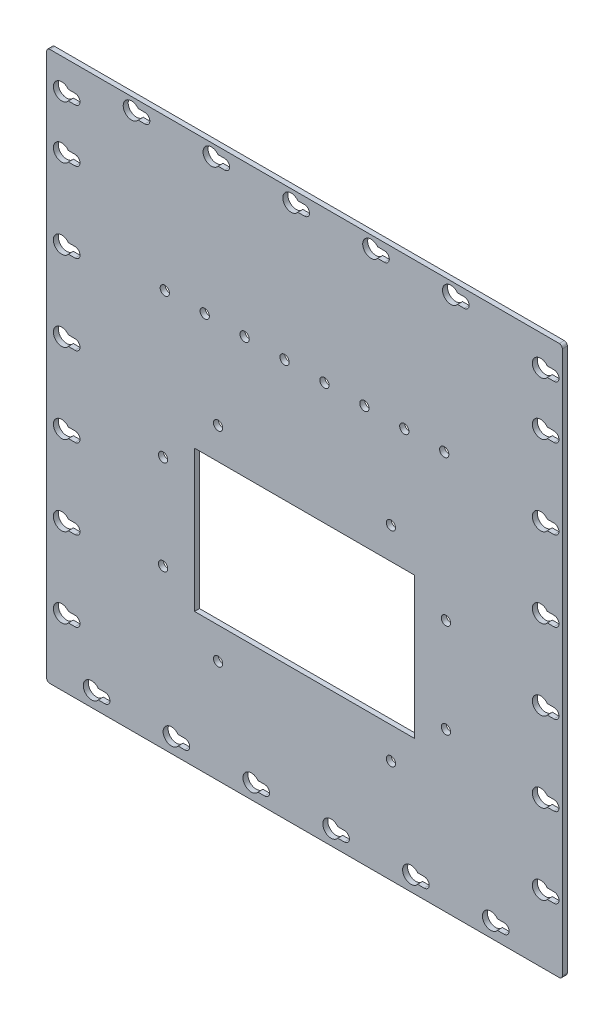
from build123d import *

# Parameters (mm, degrees)
SKETCH1_W                = 164.1
SKETCH1_H                = 174.745
BOSS_EXTRUDE1_DEPTH      = 1.5875
FILLET1_R                = 1
SKETCH2_R                = 1.4732
CUT_EXTRUDE1_DEPTH       = 10
HEAT_STRAP_CONNECTIONS_R = 1.4732
CUT_EXTRUDE2_DEPTH       = 241.065605994


with BuildPart() as part:
    # Sketch1 → Boss-Extrude1 (new body)
    with BuildSketch(Plane.XY):
        with Locations((82.55, -87.3725)):
            Rectangle(SKETCH1_W, SKETCH1_H)
        with BuildLine():
            Line((82.55, -5.4375), (80.434372699, -5.4375))
            ThreePointArc((80.434372699, -5.4375), (75.6625, -3.85), (80.434372699, -2.2625))
            Line((80.434372699, -2.2625), (82.55, -2.2625))
            ThreePointArc((82.55, -2.2625), (84.1375, -3.85), (82.55, -5.4375))
        make_face(mode=Mode.SUBTRACT)
        with BuildLine():
            Line((16.934372699, -168.395), (19.05, -168.395))
            ThreePointArc((19.05, -168.395), (20.6375, -169.9825), (19.05, -171.57))
            Line((19.05, -171.57), (16.934372699, -171.57))
            ThreePointArc((16.934372699, -171.57), (12.1625, -169.9825), (16.934372699, -168.395))
        make_face(mode=Mode.SUBTRACT)
        with BuildLine():
            Line((7.409372699, -151.9325), (9.525, -151.9325))
            ThreePointArc((9.525, -151.9325), (11.1125, -153.52), (9.525, -155.1075))
            Line((9.525, -155.1075), (7.409372699, -155.1075))
            ThreePointArc((7.409372699, -155.1075), (2.6375, -153.52), (7.409372699, -151.9325))
        make_face(mode=Mode.SUBTRACT)
        with BuildLine():
            Line((42.334372699, -168.395), (44.45, -168.395))
            ThreePointArc((44.45, -168.395), (46.0375, -169.9825), (44.45, -171.57))
            Line((44.45, -171.57), (42.334372699, -171.57))
            ThreePointArc((42.334372699, -171.57), (37.5625, -169.9825), (42.334372699, -168.395))
        make_face(mode=Mode.SUBTRACT)
        with BuildLine():
            Line((67.734372699, -168.395), (69.85, -168.395))
            ThreePointArc((69.85, -168.395), (71.4375, -169.9825), (69.85, -171.57))
            Line((69.85, -171.57), (67.734372699, -171.57))
            ThreePointArc((67.734372699, -171.57), (62.9625, -169.9825), (67.734372699, -168.395))
        make_face(mode=Mode.SUBTRACT)
        with BuildLine():
            Line((7.409372699, -126.5325), (9.525, -126.5325))
            ThreePointArc((9.525, -126.5325), (11.1125, -128.12), (9.525, -129.7075))
            Line((9.525, -129.7075), (7.409372699, -129.7075))
            ThreePointArc((7.409372699, -129.7075), (2.6375, -128.12), (7.409372699, -126.5325))
        make_face(mode=Mode.SUBTRACT)
        with BuildLine():
            Line((7.409372699, -101.1325), (9.525, -101.1325))
            ThreePointArc((9.525, -101.1325), (11.1125, -102.72), (9.525, -104.3075))
            Line((9.525, -104.3075), (7.409372699, -104.3075))
            ThreePointArc((7.409372699, -104.3075), (2.6375, -102.72), (7.409372699, -101.1325))
        make_face(mode=Mode.SUBTRACT)
        with BuildLine():
            Line((7.409372699, -75.7325), (9.525, -75.7325))
            ThreePointArc((9.525, -75.7325), (11.1125, -77.32), (9.525, -78.9075))
            Line((9.525, -78.9075), (7.409372699, -78.9075))
            ThreePointArc((7.409372699, -78.9075), (2.6375, -77.32), (7.409372699, -75.7325))
        make_face(mode=Mode.SUBTRACT)
        with BuildLine():
            Line((7.409372699, -50.3325), (9.525, -50.3325))
            ThreePointArc((9.525, -50.3325), (11.1125, -51.92), (9.525, -53.5075))
            Line((9.525, -53.5075), (7.409372699, -53.5075))
            ThreePointArc((7.409372699, -53.5075), (2.6375, -51.92), (7.409372699, -50.3325))
        make_face(mode=Mode.SUBTRACT)
        with BuildLine():
            Line((7.409372699, -24.9325), (9.525, -24.9325))
            ThreePointArc((9.525, -24.9325), (11.1125, -26.52), (9.525, -28.1075))
            Line((9.525, -28.1075), (7.409372699, -28.1075))
            ThreePointArc((7.409372699, -28.1075), (2.6375, -26.52), (7.409372699, -24.9325))
        make_face(mode=Mode.SUBTRACT)
        with BuildLine():
            Line((7.409372699, -8.1), (9.525, -8.1))
            ThreePointArc((9.525, -8.1), (11.1125, -9.6875), (9.525, -11.275))
            Line((9.525, -11.275), (7.409372699, -11.275))
            ThreePointArc((7.409372699, -11.275), (2.6375, -9.6875), (7.409372699, -8.1))
        make_face(mode=Mode.SUBTRACT)
        with BuildLine():
            Line((29.634372699, -2.2625), (31.75, -2.2625))
            ThreePointArc((31.75, -2.2625), (33.3375, -3.85), (31.75, -5.4375))
            Line((31.75, -5.4375), (29.634372699, -5.4375))
            ThreePointArc((29.634372699, -5.4375), (24.8625, -3.85), (29.634372699, -2.2625))
        make_face(mode=Mode.SUBTRACT)
        with BuildLine():
            Line((55.034372699, -2.2625), (57.15, -2.2625))
            ThreePointArc((57.15, -2.2625), (58.7375, -3.85), (57.15, -5.4375))
            Line((57.15, -5.4375), (55.034372699, -5.4375))
            ThreePointArc((55.034372699, -5.4375), (50.2625, -3.85), (55.034372699, -2.2625))
        make_face(mode=Mode.SUBTRACT)
        with BuildLine():
            ThreePointArc((161.925, -8.1), (163.5125, -9.6875), (161.925, -11.275))
            Line((161.925, -11.275), (159.809372699, -11.275))
            ThreePointArc((159.809372699, -11.275), (155.0375, -9.6875), (159.809372699, -8.1))
            Line((159.809372699, -8.1), (161.925, -8.1))
        make_face(mode=Mode.SUBTRACT)
        with BuildLine():
            Line((93.134372699, -168.395), (95.25, -168.395))
            ThreePointArc((95.25, -168.395), (96.8375, -169.9825), (95.25, -171.57))
            Line((95.25, -171.57), (93.134372699, -171.57))
            ThreePointArc((93.134372699, -171.57), (88.3625, -169.9825), (93.134372699, -168.395))
        make_face(mode=Mode.SUBTRACT)
        with BuildLine():
            Line((118.534372699, -168.395), (120.65, -168.395))
            ThreePointArc((120.65, -168.395), (122.2375, -169.9825), (120.65, -171.57))
            Line((120.65, -171.57), (118.534372699, -171.57))
            ThreePointArc((118.534372699, -171.57), (113.7625, -169.9825), (118.534372699, -168.395))
        make_face(mode=Mode.SUBTRACT)
        with BuildLine():
            Line((143.934372699, -168.395), (146.05, -168.395))
            ThreePointArc((146.05, -168.395), (147.6375, -169.9825), (146.05, -171.57))
            Line((146.05, -171.57), (143.934372699, -171.57))
            ThreePointArc((143.934372699, -171.57), (139.1625, -169.9825), (143.934372699, -168.395))
        make_face(mode=Mode.SUBTRACT)
        with BuildLine():
            Line((159.809372699, -151.9325), (161.925, -151.9325))
            ThreePointArc((161.925, -151.9325), (163.5125, -153.52), (161.925, -155.1075))
            Line((161.925, -155.1075), (159.809372699, -155.1075))
            ThreePointArc((159.809372699, -155.1075), (155.0375, -153.52), (159.809372699, -151.9325))
        make_face(mode=Mode.SUBTRACT)
        with BuildLine():
            Line((159.809372699, -126.5325), (161.925, -126.5325))
            ThreePointArc((161.925, -126.5325), (163.5125, -128.12), (161.925, -129.7075))
            Line((161.925, -129.7075), (159.809372699, -129.7075))
            ThreePointArc((159.809372699, -129.7075), (155.0375, -128.12), (159.809372699, -126.5325))
        make_face(mode=Mode.SUBTRACT)
        with BuildLine():
            Line((159.809372699, -101.1325), (161.925, -101.1325))
            ThreePointArc((161.925, -101.1325), (163.5125, -102.72), (161.925, -104.3075))
            Line((161.925, -104.3075), (159.809372699, -104.3075))
            ThreePointArc((159.809372699, -104.3075), (155.0375, -102.72), (159.809372699, -101.1325))
        make_face(mode=Mode.SUBTRACT)
        with BuildLine():
            Line((159.809372699, -75.7325), (161.925, -75.7325))
            ThreePointArc((161.925, -75.7325), (163.5125, -77.32), (161.925, -78.9075))
            Line((161.925, -78.9075), (159.809372699, -78.9075))
            ThreePointArc((159.809372699, -78.9075), (155.0375, -77.32), (159.809372699, -75.7325))
        make_face(mode=Mode.SUBTRACT)
        with BuildLine():
            Line((159.809372699, -50.3325), (161.925, -50.3325))
            ThreePointArc((161.925, -50.3325), (163.5125, -51.92), (161.925, -53.5075))
            Line((161.925, -53.5075), (159.809372699, -53.5075))
            ThreePointArc((159.809372699, -53.5075), (155.0375, -51.92), (159.809372699, -50.3325))
        make_face(mode=Mode.SUBTRACT)
        with BuildLine():
            Line((105.834372699, -2.2625), (107.95, -2.2625))
            ThreePointArc((107.95, -2.2625), (109.5375, -3.85), (107.95, -5.4375))
            Line((107.95, -5.4375), (105.834372699, -5.4375))
            ThreePointArc((105.834372699, -5.4375), (101.0625, -3.85), (105.834372699, -2.2625))
        make_face(mode=Mode.SUBTRACT)
        with BuildLine():
            Line((159.809372699, -24.9325), (161.925, -24.9325))
            ThreePointArc((161.925, -24.9325), (163.5125, -26.52), (161.925, -28.1075))
            Line((161.925, -28.1075), (159.809372699, -28.1075))
            ThreePointArc((159.809372699, -28.1075), (155.0375, -26.52), (159.809372699, -24.9325))
        make_face(mode=Mode.SUBTRACT)
        with BuildLine():
            Line((131.234372699, -2.2625), (133.35, -2.2625))
            ThreePointArc((133.35, -2.2625), (134.9375, -3.85), (133.35, -5.4375))
            Line((133.35, -5.4375), (131.234372699, -5.4375))
            ThreePointArc((131.234372699, -5.4375), (126.4625, -3.85), (131.234372699, -2.2625))
        make_face(mode=Mode.SUBTRACT)
    extrude(amount=BOSS_EXTRUDE1_DEPTH)

    # Fillet1
    fillet1_edges = [part.edges().sort_by_distance(p)[0] for p in [
        (164.6, -174.745, 0.79375),
        (0.5, -174.745, 0.79375),
        (0.5, 0, 0.79375),
        (164.6, 0, 0.79375),
    ]]
    fillet(fillet1_edges, radius=FILLET1_R)

    # Sketch2 → Cut-Extrude1 (cut)
    with BuildSketch(Plane.XY.offset(1.5875)):
        Polygon((117.55, -86.8725), (47.55, -86.8725), (47.55, -126.8725), (47.55, -131.8725), (117.55, -131.8725), (117.55, -126.8725), align=None)
        with Locations((110.05, -76.8725)):
            Circle(SKETCH2_R)
        with Locations((37.55, -94.3725)):
            Circle(SKETCH2_R)
        with Locations((37.55, -124.3725)):
            Circle(SKETCH2_R)
        with Locations((110.05, -141.8725)):
            Circle(SKETCH2_R)
        with Locations((55.05, -141.8725)):
            Circle(SKETCH2_R)
        with Locations((55.05, -76.8725)):
            Circle(SKETCH2_R)
        with Locations((127.55, -94.3725)):
            Circle(SKETCH2_R)
        with Locations((127.55, -124.3725)):
            Circle(SKETCH2_R)
    extrude(amount=-CUT_EXTRUDE1_DEPTH, mode=Mode.SUBTRACT)

    # Heat Strap Connections → Cut-Extrude2 (cut, through all)
    with BuildSketch(Plane.XY.offset(1.5875)):
        with Locations((38.1, -48.175)):
            Circle(HEAT_STRAP_CONNECTIONS_R)
        with Locations((50.8, -48.175)):
            Circle(HEAT_STRAP_CONNECTIONS_R)
        with Locations((63.5, -48.175)):
            Circle(HEAT_STRAP_CONNECTIONS_R)
        with Locations((76.2, -48.175)):
            Circle(HEAT_STRAP_CONNECTIONS_R)
        with Locations((88.9, -48.175)):
            Circle(HEAT_STRAP_CONNECTIONS_R)
        with Locations((101.6, -48.175)):
            Circle(HEAT_STRAP_CONNECTIONS_R)
        with Locations((114.3, -48.175)):
            Circle(HEAT_STRAP_CONNECTIONS_R)
        with Locations((127, -48.175)):
            Circle(HEAT_STRAP_CONNECTIONS_R)
    extrude(amount=-CUT_EXTRUDE2_DEPTH, mode=Mode.SUBTRACT)


solid = part.part
